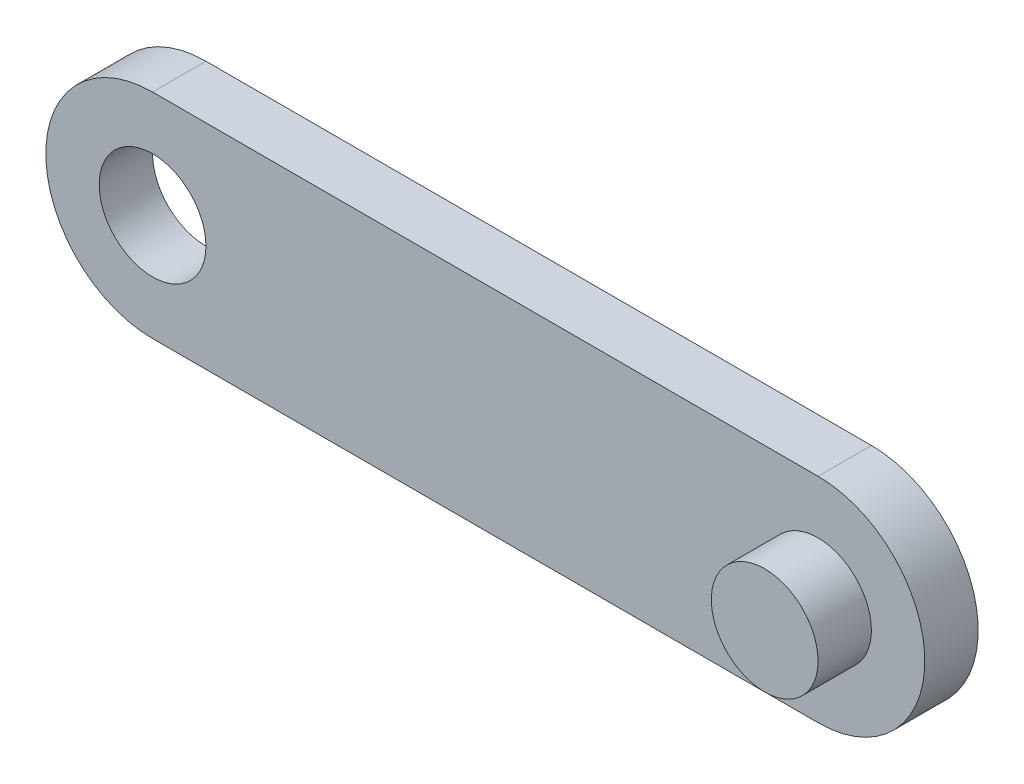
from build123d import *

# Parameters (mm, degrees)
SKETCH_1_R      = 10
EXTRUDE_1_DEPTH = 10
SKETCH_2_R      = 10
EXTRUDE_2_DEPTH = 10


with BuildPart() as part:
    # 스케치1 → 보스-돌출1 (new body)
    with BuildSketch(Plane.XY):
        with BuildLine():
            Line((0, 20), (124.680874083, 20))
            ThreePointArc((124.680874083, 20), (144.680874083, 0), (124.680874083, -20))
            Line((124.680874083, -20), (0, -20))
            ThreePointArc((0, -20), (-20, 0), (0, 20))
        make_face()
        Circle(SKETCH_1_R, mode=Mode.SUBTRACT)
    extrude(amount=EXTRUDE_1_DEPTH)

    # 스케치2 → 보스-돌출2 (add)
    with BuildSketch(Plane.XY.offset(10)):
        with Locations((124.680874083, 0)):
            Circle(SKETCH_2_R)
    extrude(amount=EXTRUDE_2_DEPTH)


solid = part.part
